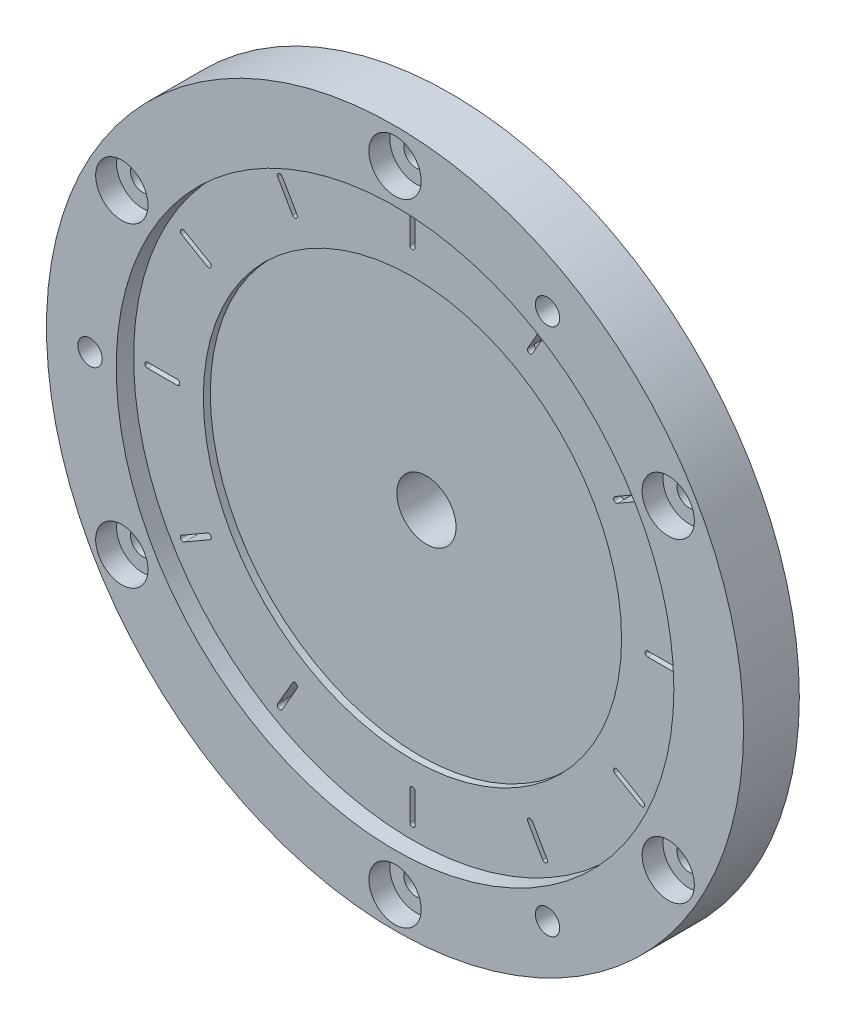
from build123d import *

# Parameters (mm, degrees)
SKETCH2_R                               = 200
BOSS_EXTRUDE1_DEPTH                     = 32
CBORE_FOR_M5_HEX_HEAD_BOLT2_D           = 14
CBORE_FOR_M5_HEX_HEAD_BOLT2_CBORE_D     = 30
CBORE_FOR_M5_HEX_HEAD_BOLT2_CBORE_DEPTH = 12
CIRPATTERN1_COUNT                       = 6
SKETCH9_R                               = 7
CUT_EXTRUDE1_DEPTH                      = 285.647149995
SKETCH12_R                              = 160
CUT_EXTRUDE7_DEPTH                      = 10
SKETCH13_R                              = 120
CUT_EXTRUDE8_DEPTH                      = 4
CUT_EXTRUDE9_DEPTH                      = 285.647149995
SKETCH16_R                              = 135
CUT_EXTRUDE10_DEPTH                     = 4
SKETCH17_R                              = 32
BOSS_EXTRUDE2_DEPTH                     = 10
FILLET1_R                               = 6
SKETCH18_R                              = 27
BOSS_EXTRUDE3_DEPTH                     = 98
SKETCH20_R                              = 21
BOSS_EXTRUDE4_DEPTH                     = 32
SKETCH19_R                              = 17
CUT_EXTRUDE11_DEPTH                     = 128


with BuildPart() as part:
    # Sketch2 → Boss-Extrude1 (new body)
    with BuildSketch(Plane.XY):
        Circle(SKETCH2_R)
    extrude(amount=BOSS_EXTRUDE1_DEPTH)

    # CBORE for M5 Hex Head Bolt2 (through all)
    with Locations(Plane.XY.offset(32)):
        with Locations((0, 180)):
            cbore_for_m5_hex_head_bolt2 = CounterBoreHole(CBORE_FOR_M5_HEX_HEAD_BOLT2_D / 2, CBORE_FOR_M5_HEX_HEAD_BOLT2_CBORE_D / 2, CBORE_FOR_M5_HEX_HEAD_BOLT2_CBORE_DEPTH)

    # CirPattern1: CBORE for M5 Hex Head Bolt2 ×6 about axis
    cirpattern1_axis = Axis((0, -1.01822753, 0), (0, 0, 1))
    for i in range(1, CIRPATTERN1_COUNT):
        add(cbore_for_m5_hex_head_bolt2.rotate(cirpattern1_axis, i * 360 / CIRPATTERN1_COUNT), mode=Mode.SUBTRACT)

    # Sketch9 → Cut-Extrude1 (cut, through all)
    with BuildSketch(Plane.XY.offset(32)):
        with Locations((-175, 0)):
            Circle(SKETCH9_R)
        with Locations((87.5, 151.554445662)):
            Circle(SKETCH9_R)
        with Locations((87.5, -151.554445662)):
            Circle(SKETCH9_R)
    extrude(amount=-CUT_EXTRUDE1_DEPTH, mode=Mode.SUBTRACT)

    # Sketch12 → Cut-Extrude7 (cut)
    with BuildSketch(Plane.XY.offset(32)):
        Circle(SKETCH12_R)
    extrude(amount=-CUT_EXTRUDE7_DEPTH, mode=Mode.SUBTRACT)

    # Sketch13 → Cut-Extrude8 (cut)
    with BuildSketch(Plane.XY.offset(22)):
        Circle(SKETCH13_R)
    extrude(amount=-CUT_EXTRUDE8_DEPTH, mode=Mode.SUBTRACT)

    # Sketch15 → Cut-Extrude9 (cut, through all)
    with BuildSketch(Plane(origin=(0, 0, 0), x_dir=(-1, 0, 0), z_dir=(0, 0, -1))):
        with BuildLine():
            Line((1.5, -135), (1.5, -152.035767594))
            ThreePointArc((1.5, -152.035767594), (0, -153.535767594), (-1.5, -152.035767594))
            Line((-1.5, -152.035767594), (-1.5, -135))
            ThreePointArc((-1.5, -135), (0, -133.5), (1.5, -135))
        make_face()
        with BuildLine():
            Line((-66.200961894, -117.663429511), (-74.718845691, -132.41683702))
            ThreePointArc((-74.718845691, -132.41683702), (-76.767883797, -132.965875126), (-77.316921902, -130.91683702))
            Line((-77.316921902, -130.91683702), (-68.799038106, -116.163429511))
            ThreePointArc((-68.799038106, -116.163429511), (-66.75, -115.614391405), (-66.200961894, -117.663429511))
        make_face()
        with BuildLine():
            Line((-116.163429511, -68.799038106), (-130.91683702, -77.316921902))
            ThreePointArc((-130.91683702, -77.316921902), (-132.965875126, -76.767883797), (-132.41683702, -74.718845691))
            Line((-132.41683702, -74.718845691), (-117.663429511, -66.200961894))
            ThreePointArc((-117.663429511, -66.200961894), (-115.614391405, -66.75), (-116.163429511, -68.799038106))
        make_face()
        with BuildLine():
            Line((-135, -1.5), (-152.035767594, -1.5))
            ThreePointArc((-152.035767594, -1.5), (-153.535767594, 0), (-152.035767594, 1.5))
            Line((-152.035767594, 1.5), (-135, 1.5))
            ThreePointArc((-135, 1.5), (-133.5, 0), (-135, -1.5))
        make_face()
        with BuildLine():
            Line((-117.663429511, 66.200961894), (-132.41683702, 74.718845691))
            ThreePointArc((-132.41683702, 74.718845691), (-132.965875126, 76.767883797), (-130.91683702, 77.316921902))
            Line((-130.91683702, 77.316921902), (-116.163429511, 68.799038106))
            ThreePointArc((-116.163429511, 68.799038106), (-115.614391405, 66.75), (-117.663429511, 66.200961894))
        make_face()
        with BuildLine():
            Line((-68.799038106, 116.163429511), (-77.316921902, 130.91683702))
            ThreePointArc((-77.316921902, 130.91683702), (-76.767883797, 132.965875126), (-74.718845691, 132.41683702))
            Line((-74.718845691, 132.41683702), (-66.200961894, 117.663429511))
            ThreePointArc((-66.200961894, 117.663429511), (-66.75, 115.614391405), (-68.799038106, 116.163429511))
        make_face()
        with BuildLine():
            Line((-1.5, 135), (-1.5, 152.035767594))
            ThreePointArc((-1.5, 152.035767594), (0, 153.535767594), (1.5, 152.035767594))
            Line((1.5, 152.035767594), (1.5, 135))
            ThreePointArc((1.5, 135), (0, 133.5), (-1.5, 135))
        make_face()
        with BuildLine():
            Line((66.200961894, 117.663429511), (74.718845691, 132.41683702))
            ThreePointArc((74.718845691, 132.41683702), (76.767883797, 132.965875126), (77.316921902, 130.91683702))
            Line((77.316921902, 130.91683702), (68.799038106, 116.163429511))
            ThreePointArc((68.799038106, 116.163429511), (66.75, 115.614391405), (66.200961894, 117.663429511))
        make_face()
        with BuildLine():
            Line((116.163429511, 68.799038106), (130.91683702, 77.316921902))
            ThreePointArc((130.91683702, 77.316921902), (132.965875126, 76.767883797), (132.41683702, 74.718845691))
            Line((132.41683702, 74.718845691), (117.663429511, 66.200961894))
            ThreePointArc((117.663429511, 66.200961894), (115.614391405, 66.75), (116.163429511, 68.799038106))
        make_face()
        with BuildLine():
            Line((135, 1.5), (152.035767594, 1.5))
            ThreePointArc((152.035767594, 1.5), (153.535767594, 0), (152.035767594, -1.5))
            Line((152.035767594, -1.5), (135, -1.5))
            ThreePointArc((135, -1.5), (133.5, 0), (135, 1.5))
        make_face()
        with BuildLine():
            Line((117.663429511, -66.200961894), (132.41683702, -74.718845691))
            ThreePointArc((132.41683702, -74.718845691), (132.965875126, -76.767883797), (130.91683702, -77.316921902))
            Line((130.91683702, -77.316921902), (116.163429511, -68.799038106))
            ThreePointArc((116.163429511, -68.799038106), (115.614391405, -66.75), (117.663429511, -66.200961894))
        make_face()
        with BuildLine():
            Line((68.799038106, -116.163429511), (77.316921902, -130.91683702))
            ThreePointArc((77.316921902, -130.91683702), (76.767883797, -132.965875126), (74.718845691, -132.41683702))
            Line((74.718845691, -132.41683702), (66.200961894, -117.663429511))
            ThreePointArc((66.200961894, -117.663429511), (66.75, -115.614391405), (68.799038106, -116.163429511))
        make_face()
    extrude(amount=-CUT_EXTRUDE9_DEPTH, mode=Mode.SUBTRACT)

    # Sketch16 → Cut-Extrude10 (cut)
    with BuildSketch(Plane.XY.offset(18)):
        Circle(SKETCH16_R)
    extrude(amount=-CUT_EXTRUDE10_DEPTH, mode=Mode.SUBTRACT)

    # Sketch17 → Boss-Extrude2 (add)
    with BuildSketch(Plane(origin=(0, 0, 0), x_dir=(-1, 0, 0), z_dir=(0, 0, -1))):
        with Locations(Location((0, 0, 0), (0, 0, 180))):
            Circle(SKETCH17_R)
    extrude(amount=BOSS_EXTRUDE2_DEPTH)

    # Fillet1
    fillet1_edges = [part.edges().sort_by_distance(p)[0] for p in [
        (-32, 0, 0),
    ]]
    fillet(fillet1_edges, radius=FILLET1_R)

    # Sketch18 → Boss-Extrude3 (add)
    with BuildSketch(Plane(origin=(0, 0, -10), x_dir=(-1, 0, 0), z_dir=(0, 0, -1))):
        Circle(SKETCH18_R)
    extrude(amount=BOSS_EXTRUDE3_DEPTH)

    # Sketch20 → Boss-Extrude4 (add)
    with BuildSketch(Plane(origin=(0, 0, -108), x_dir=(-1, 0, 0), z_dir=(0, 0, -1))):
        Circle(SKETCH20_R)
    extrude(amount=-BOSS_EXTRUDE4_DEPTH)

    # Sketch19 → Cut-Extrude11 (cut)
    with BuildSketch(Plane(origin=(0, 0, -108), x_dir=(-1, 0, 0), z_dir=(0, 0, -1))):
        Circle(SKETCH19_R)
    extrude(amount=-CUT_EXTRUDE11_DEPTH, mode=Mode.SUBTRACT)


solid = part.part
